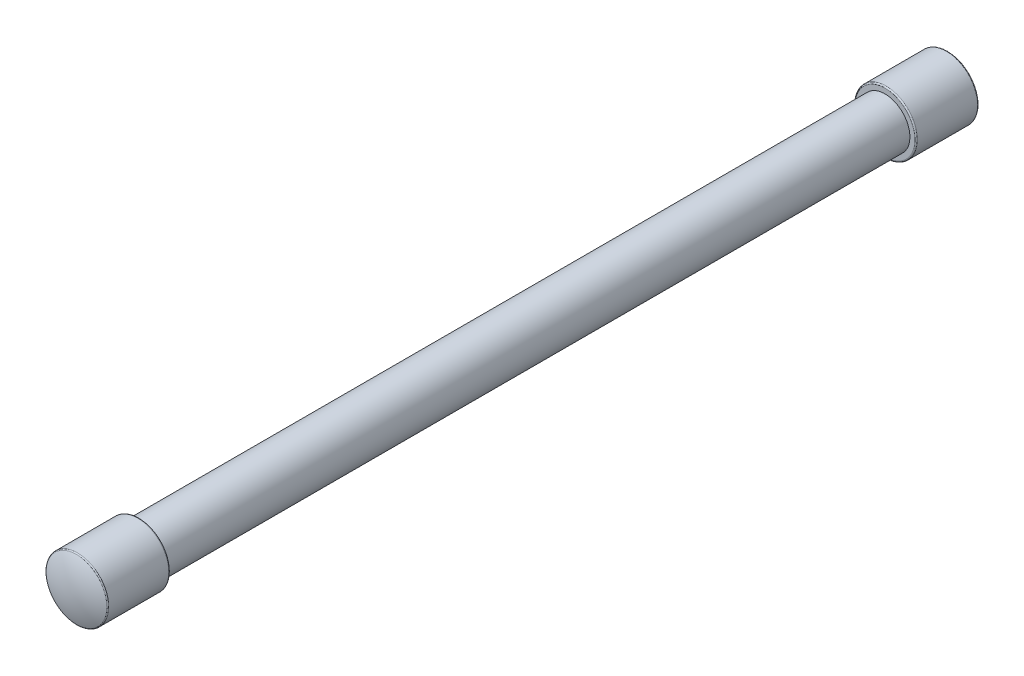
from build123d import *

# Parameters (mm, degrees)
FILLET1_R = 0.2


with BuildPart() as part:
    # Sketch1 → Revolve1 (revolve)
    with BuildSketch(Plane(origin=(0, 0, 0), x_dir=(0, 0, -1), z_dir=(1, 0, 0)), mode=Mode.PRIVATE) as revolve1_sk:
        with BuildLine():
            Line((0, 0), (71.091287885, 0))
            ThreePointArc((71.091287885, 0), (70.815292009, 2.558852734), (70, 5))
            Line((70, 5), (60, 5))
            Line((60, 5), (60, 4))
            Line((60, 4), (0, 4))
            Line((0, 4), (0, 0))
        make_face()
    revolve(revolve1_sk.sketch.rotate(Axis((0, 0, 0), (0, 0, -1)), 90), axis=Axis((0, 0, 0), (0, 0, -1)))

    # Mirror1: part across plane


with BuildPart() as part_1:
    add(part.part)
    add(part.part.mirror(Plane.XY))

    # Fillet1
    fillet1_edges = [part_1.edges().sort_by_distance(p)[0] for p in [
        (-5, 0, 60),
        (-5, 0, 70),
        (-5, 0, -70),
        (-5, 0, -60),
    ]]
    fillet(fillet1_edges, radius=FILLET1_R)


solid = part_1.part
